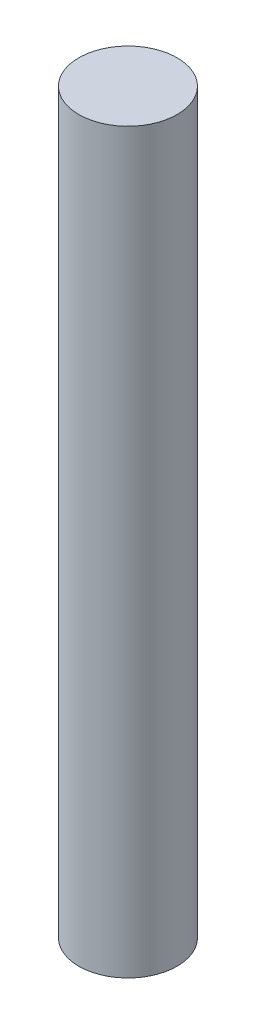
from build123d import *

# Parameters (mm, degrees)
SKETCH1_R           = 10
BOSS_EXTRUDE1_DEPTH = 150


with BuildPart() as part:
    # Sketch1 → Boss-Extrude1 (new body)
    with BuildSketch(Plane(origin=(0, 0, 0), x_dir=(1, 0, 0), z_dir=(0, 1, 0))):
        with Locations(Location((0, 0, 0), (0, 0, 270))):
            Circle(SKETCH1_R)
    extrude(amount=BOSS_EXTRUDE1_DEPTH)


solid = part.part
